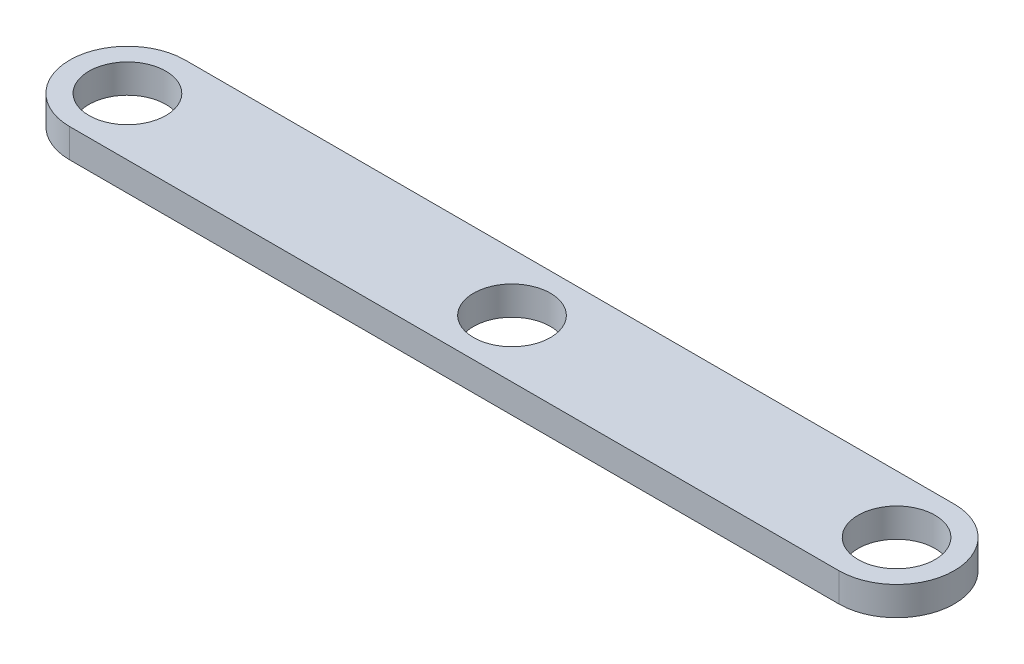
from build123d import *

# Parameters (mm, degrees)
SKETCH1_R           = 4
BOSS_EXTRUDE1_DEPTH = 3
SKETCH2_R           = 4
CUT_EXTRUDE1_DEPTH  = 87.261231153


with BuildPart() as part:
    # Sketch1 → Boss-Extrude1 (new body)
    with BuildSketch(Plane(origin=(0, 0, 0), x_dir=(1, 0, 0), z_dir=(0, 1, 0))):
        with BuildLine():
            Line((0, 6), (80, 6))
            ThreePointArc((80, 6), (86, 0), (80, -6))
            Line((80, -6), (0, -6))
            ThreePointArc((0, -6), (-6, 0), (0, 6))
        make_face()
        with Locations(Location((0, 0, 0), (0, 0, 270))):
            Circle(SKETCH1_R, mode=Mode.SUBTRACT)
        with Locations(Location((80, 0, 0), (0, 0, 270))):
            Circle(SKETCH1_R, mode=Mode.SUBTRACT)
    extrude(amount=BOSS_EXTRUDE1_DEPTH)

    # Sketch2 → Cut-Extrude1 (cut, through all)
    with BuildSketch(Plane(origin=(0, 3, 0), x_dir=(1, 0, 0), z_dir=(0, 1, 0))):
        with Locations(Location((40, 0, 0), (0, 0, 270))):
            Circle(SKETCH2_R)
    extrude(amount=-CUT_EXTRUDE1_DEPTH, mode=Mode.SUBTRACT)


solid = part.part
